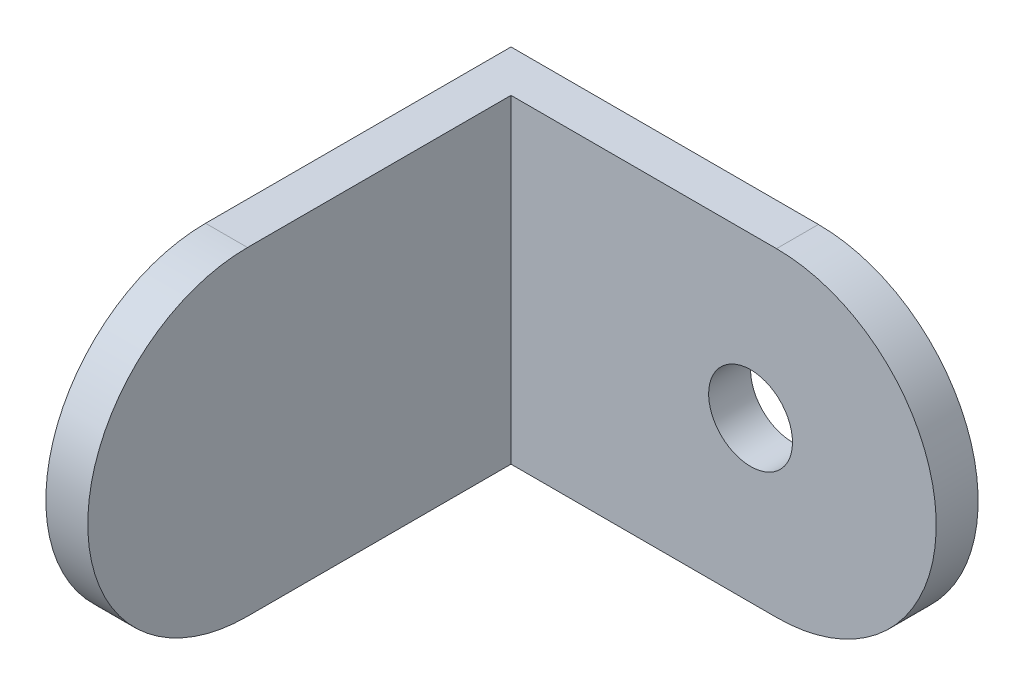
from build123d import *

# Parameters (mm, degrees)
SKETCH1_W                      = 2.1
SKETCH1_H                      = 8
REVOLVE1_ANGLE                 = 180
SKETCH2_W                      = 2.1
SKETCH2_H                      = 16
BOSS_EXTRUDE1_DEPTH            = 13.2
BOSS_EXTRUDE2_DEPTH            = 2.1
F_4_2_4_2_DIAMETER_HOLE1_D     = 4.2
F_4_2_4_2_DIAMETER_HOLE1_DEPTH = 23.3


with BuildPart() as part:
    # Sketch1 → Revolve1 (revolve)
    with BuildSketch(Plane(origin=(0, 0, 15.3), x_dir=(-1, 0, 0), z_dir=(0, 0, -1))):
        with Locations((-1.05, 12)):
            Rectangle(SKETCH1_W, SKETCH1_H)
    revolve(axis=Axis((2.1, 8, 15.3), (1, 0, 0)), revolution_arc=REVOLVE1_ANGLE)

    # Sketch2 → Boss-Extrude1 (add)
    with BuildSketch(Plane(origin=(0, 0, 15.3), x_dir=(-1, 0, 0), z_dir=(0, 0, -1))):
        with Locations((-1.05, 8)):
            Rectangle(SKETCH2_W, SKETCH2_H)
    extrude(amount=BOSS_EXTRUDE1_DEPTH)

    # Sketch3 → Boss-Extrude2 (add)
    with BuildSketch(Plane(origin=(0, 0, 2.1), x_dir=(-1, 0, 0), z_dir=(0, 0, -1))):
        with BuildLine():
            Line((-15.4, 16), (0, 16))
            Line((0, 16), (0, 0))
            Line((0, 0), (-15.4, 0))
            ThreePointArc((-15.4, 0), (-23.4, 8), (-15.4, 16))
        make_face()
    extrude(amount=BOSS_EXTRUDE2_DEPTH)

    # Ø4.2 (4.2) Diameter Hole1
    with Locations(Plane(origin=(0, 0, 0), x_dir=(-1, 0, 0), z_dir=(0, 0, -1))):
        with Locations((-14.1, 8)):
            Hole(F_4_2_4_2_DIAMETER_HOLE1_D / 2, depth=F_4_2_4_2_DIAMETER_HOLE1_DEPTH)


solid = part.part
